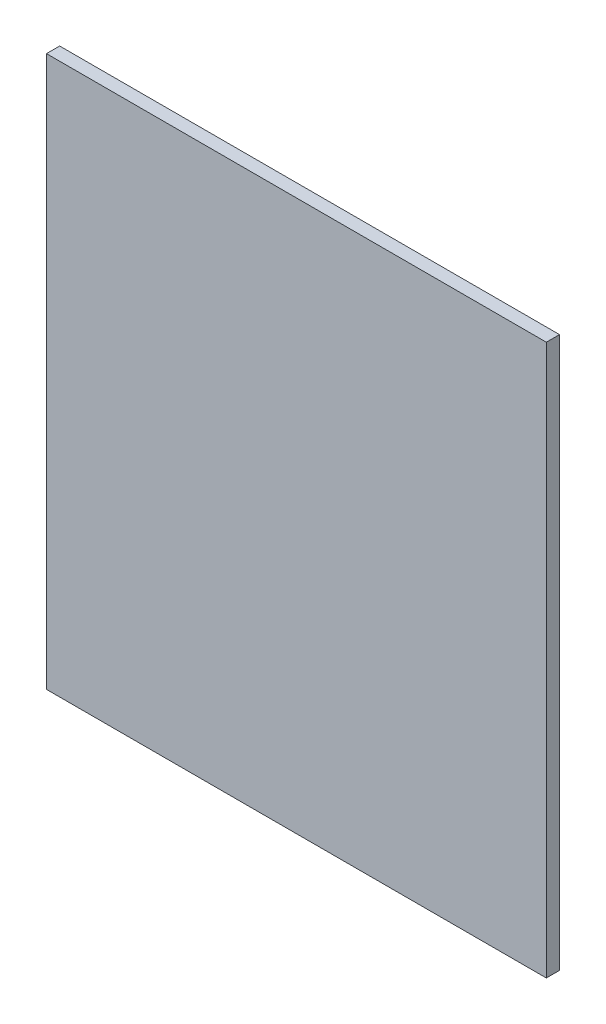
from build123d import *

# Parameters (mm, degrees)
SKETCH_1_W      = 75.8
SKETCH_1_H      = 83.5
EXTRUDE_1_DEPTH = 2


with BuildPart() as part:
    # Эскиз1 → Бобышка-Вытянуть1 (new body)
    with BuildSketch(Plane.XY):
        with Locations((37.9, 41.75)):
            Rectangle(SKETCH_1_W, SKETCH_1_H)
    extrude(amount=EXTRUDE_1_DEPTH)


solid = part.part
